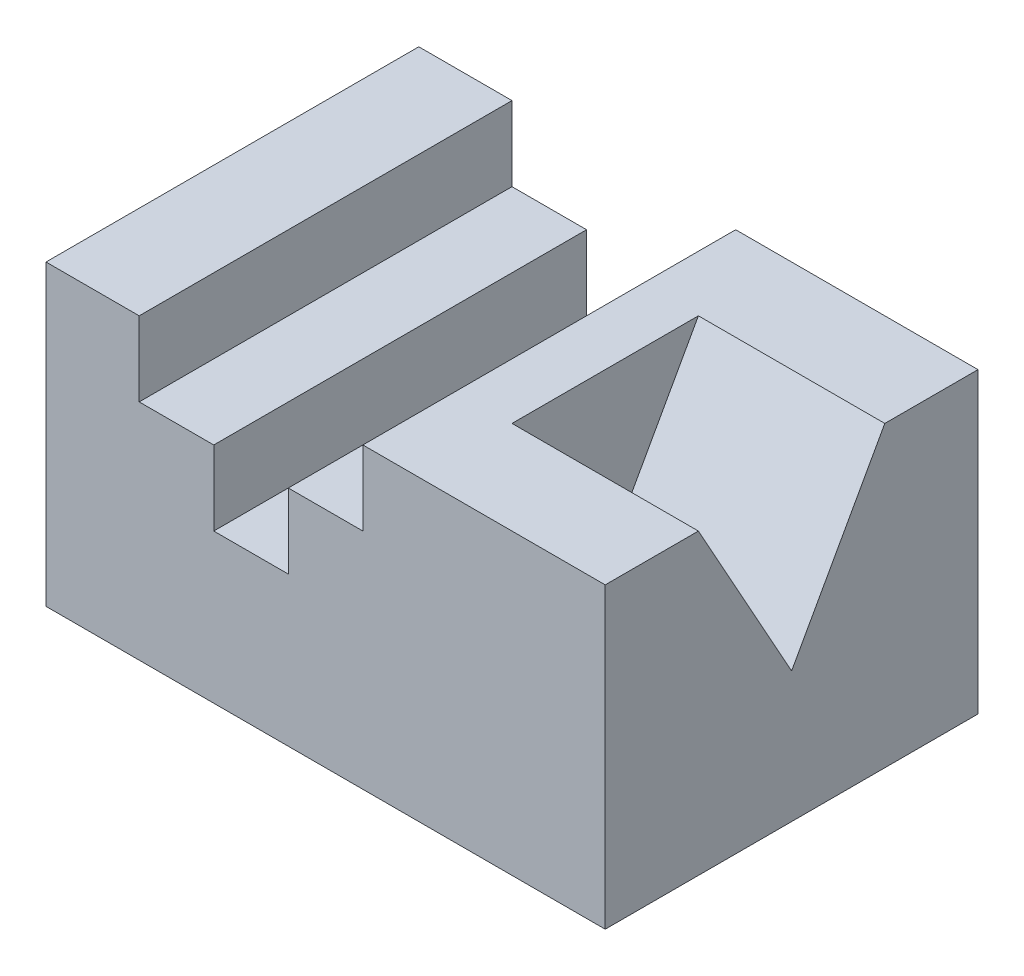
from build123d import *

# Parameters (mm, degrees)
BOSS_EXTRUDE1_DEPTH     = 100
CUT_EXTRUDE2_DEPTH      = 198.230829233
CUT_EXTRUDE2_DEPTH_BACK = 50


with BuildPart() as part:
    # Sketch1 → Boss-Extrude1 (new body)
    with BuildSketch(Plane.XY):
        Polygon((0, 0), (0, 80), (25, 80), (25, 60), (45, 60), (45, 40), (65, 40), (65, 60), (85, 60), (85, 80), (150, 80), (150, 0), align=None)
    extrude(amount=-BOSS_EXTRUDE1_DEPTH)

    # Sketch2 → Cut-Extrude2 (cut, two sides: drawn at the far end of the back side and taken through both)
    with BuildSketch(Plane(origin=(150, 0, 0), x_dir=(0, 0, -1), z_dir=(1, 0, 0)).offset(-CUT_EXTRUDE2_DEPTH_BACK)):
        Polygon((-86.366239295, 280.459230731), (25, 80), (50, 35), (75, 80), (186.366239295, 280.459230731), (186.366239295, 739.09347472), (-86.366239295, 739.09347472), align=None)
    extrude(amount=CUT_EXTRUDE2_DEPTH + CUT_EXTRUDE2_DEPTH_BACK, mode=Mode.SUBTRACT)


solid = part.part
